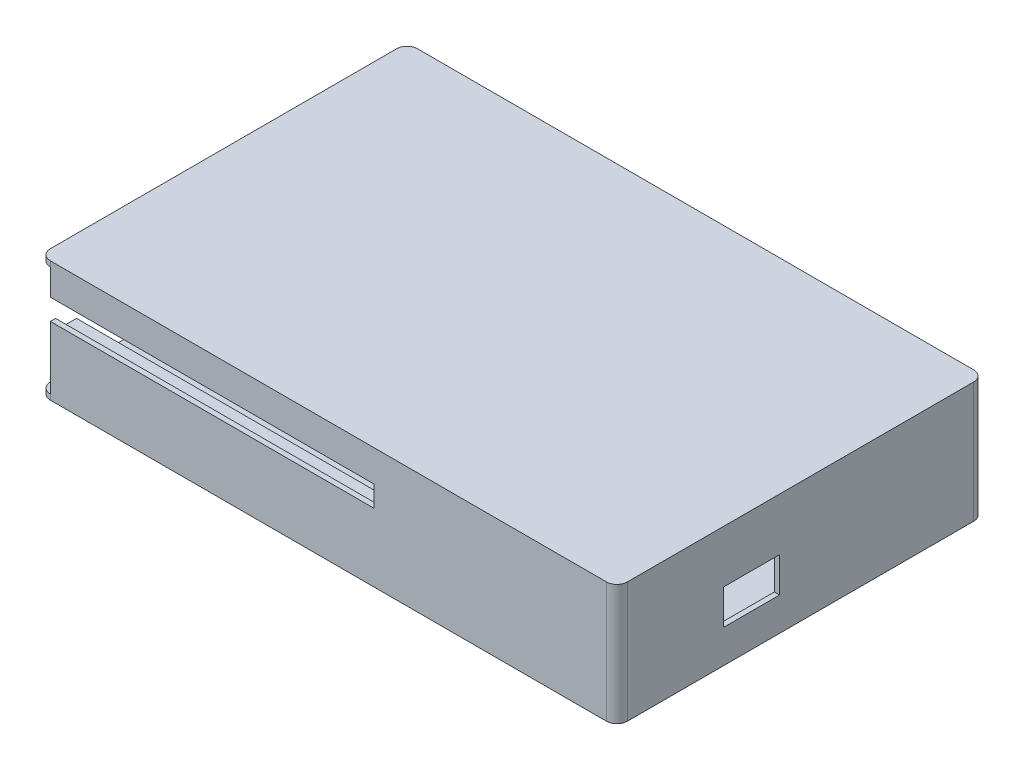
from build123d import *

# Parameters (mm, degrees)
BOSS_EXTRUDE1_DEPTH  = 0.75
BOSS_EXTRUDE2_DEPTH  = 3.75
BOSS_EXTRUDE3_DEPTH  = 9.75
SKETCH1_5_W          = 0.75
SKETCH1_5_H          = 8
BOSS_EXTRUDE4_DEPTH  = 4.75
BOSS_EXTRUDE5_START  = 9.75
BOSS_EXTRUDE5_DEPTH  = 7
BOSS_EXTRUDE6_START  = 5.25
BOSS_EXTRUDE6_DEPTH  = 3
BOSS_EXTRUDE7_START  = 12.75
SKETCH1_11_W         = 46.25
SKETCH1_11_H         = 0.75
BOSS_EXTRUDE7_DEPTH  = 4
BOSS_EXTRUDE9_START  = 16.5
BOSS_EXTRUDE9_DEPTH  = 0.75
SKETCH3_W            = 80.25
SKETCH3_H            = 3
BOSS_EXTRUDE10_DEPTH = 1.5
SKETCH6_W            = 80.25
SKETCH6_H            = 3
BOSS_EXTRUDE11_DEPTH = 1.5
SKETCH4_R            = 0.6
CUT_EXTRUDE1_DEPTH   = 79
SKETCH7_R            = 0.6
CUT_EXTRUDE2_DEPTH   = 79


with BuildPart() as part:
    # Sketch1 → Boss-Extrude1 (new body)
    with BuildSketch(Plane(origin=(0, 0, 0), x_dir=(1, 0, 0), z_dir=(0, 1, 0))):
        with BuildLine():
            Line((0.75, 51.75), (80.25, 51.75))
            ThreePointArc((80.25, 51.75), (81.310660172, 51.310660172), (81.75, 50.25))
            Line((81.75, 50.25), (81.75, 0.75))
            ThreePointArc((81.75, 0.75), (81.310660172, -0.310660172), (80.25, -0.75))
            Line((80.25, -0.75), (0.75, -0.75))
            ThreePointArc((0.75, -0.75), (-0.310660172, -0.310660172), (-0.75, 0.75))
            Line((-0.75, 0.75), (-0.75, 50.25))
            ThreePointArc((-0.75, 50.25), (-0.310660172, 51.310660172), (0.75, 51.75))
        make_face()
    extrude(amount=BOSS_EXTRUDE1_DEPTH)

    # Sketch1<3> → Boss-Extrude2 (add)
    with BuildSketch(Plane(origin=(0, 0, 0), x_dir=(1, 0, 0), z_dir=(0, 1, 0))):
        with BuildLine():
            Line((80.25, 51), (0.75, 51))
            Line((0.75, 51), (0.75, 49.5))
            Line((0.75, 49.5), (81, 49.5))
            Line((81, 49.5), (81, 50.25))
            ThreePointArc((81, 50.25), (80.780330086, 50.780330086), (80.25, 51))
        make_face()
        with BuildLine():
            Line((81, 1.5), (0.75, 1.5))
            Line((0.75, 1.5), (0.75, 0))
            Line((0.75, 0), (80.25, 0))
            ThreePointArc((80.25, 0), (80.780330086, 0.219669914), (81, 0.75))
            Line((81, 0.75), (81, 1.5))
        make_face()
    extrude(amount=BOSS_EXTRUDE2_DEPTH)

    # Sketch1<4> → Boss-Extrude3 (add)
    with BuildSketch(Plane(origin=(0, 0, 0), x_dir=(1, 0, 0), z_dir=(0, 1, 0))):
        with BuildLine():
            Line((0.75, 51.75), (0.75, 51))
            Line((0.75, 51), (80.25, 51))
            ThreePointArc((80.25, 51), (80.780330086, 50.780330086), (81, 50.25))
            Line((81, 50.25), (81, 22.5))
            Line((81, 22.5), (81.75, 22.5))
            Line((81.75, 22.5), (81.75, 50.25))
            ThreePointArc((81.75, 50.25), (81.310660172, 51.310660172), (80.25, 51.75))
            Line((80.25, 51.75), (0.75, 51.75))
        make_face()
        with BuildLine():
            Line((0.75, 0), (0.75, -0.75))
            Line((0.75, -0.75), (80.25, -0.75))
            ThreePointArc((80.25, -0.75), (81.310660172, -0.310660172), (81.75, 0.75))
            Line((81.75, 0.75), (81.75, 14.5))
            Line((81.75, 14.5), (81, 14.5))
            Line((81, 14.5), (81, 0.75))
            ThreePointArc((81, 0.75), (80.780330086, 0.219669914), (80.25, 0))
            Line((80.25, 0), (0.75, 0))
        make_face()
    extrude(amount=BOSS_EXTRUDE3_DEPTH)

    # Sketch1<5> → Boss-Extrude4 (add)
    with BuildSketch(Plane(origin=(0, 0, 0), x_dir=(1, 0, 0), z_dir=(0, 1, 0))):
        with Locations((81.375, 18.5)):
            Rectangle(SKETCH1_5_W, SKETCH1_5_H)
    extrude(amount=BOSS_EXTRUDE4_DEPTH)

    # Sketch1<8> → Boss-Extrude5 (add)
    with BuildSketch(Plane(origin=(0, 0, 0), x_dir=(1, 0, 0), z_dir=(0, 1, 0)).offset(BOSS_EXTRUDE5_START)):
        with BuildLine():
            Line((80.25, 51.75), (47, 51.75))
            Line((47, 51.75), (47, 51))
            Line((47, 51), (80.25, 51))
            ThreePointArc((80.25, 51), (80.780330086, 50.780330086), (81, 50.25))
            Line((81, 50.25), (81, 0.75))
            ThreePointArc((81, 0.75), (80.780330086, 0.219669914), (80.25, 0))
            Line((80.25, 0), (47, 0))
            Line((47, 0), (47, -0.75))
            Line((47, -0.75), (80.25, -0.75))
            ThreePointArc((80.25, -0.75), (81.310660172, -0.310660172), (81.75, 0.75))
            Line((81.75, 0.75), (81.75, 50.25))
            ThreePointArc((81.75, 50.25), (81.310660172, 51.310660172), (80.25, 51.75))
        make_face()
    extrude(amount=BOSS_EXTRUDE5_DEPTH)

    # Sketch1<9> → Boss-Extrude6 (add)
    with BuildSketch(Plane(origin=(0, 0, 0), x_dir=(1, 0, 0), z_dir=(0, 1, 0)).offset(BOSS_EXTRUDE6_START)):
        with BuildLine():
            Line((80.25, 51), (0.75, 51))
            Line((0.75, 51), (0.75, 49.5))
            Line((0.75, 49.5), (81, 49.5))
            Line((81, 49.5), (81, 50.25))
            ThreePointArc((81, 50.25), (80.780330086, 50.780330086), (80.25, 51))
        make_face()
        with BuildLine():
            Line((81, 1.5), (0.75, 1.5))
            Line((0.75, 1.5), (0.75, 0))
            Line((0.75, 0), (80.25, 0))
            ThreePointArc((80.25, 0), (80.780330086, 0.219669914), (81, 0.75))
            Line((81, 0.75), (81, 1.5))
        make_face()
    extrude(amount=BOSS_EXTRUDE6_DEPTH)

    # Sketch1<11> → Boss-Extrude7 (add)
    with BuildSketch(Plane(origin=(0, 0, 0), x_dir=(1, 0, 0), z_dir=(0, 1, 0)).offset(BOSS_EXTRUDE7_START)):
        with Locations((23.875, 51.375)):
            Rectangle(SKETCH1_11_W, SKETCH1_11_H)
        with Locations((23.875, -0.375)):
            Rectangle(SKETCH1_11_W, SKETCH1_11_H)
    extrude(amount=BOSS_EXTRUDE7_DEPTH)

    # Sketch1<12> → Boss-Extrude9 (add)
    with BuildSketch(Plane(origin=(0, 0, 0), x_dir=(1, 0, 0), z_dir=(0, 1, 0)).offset(BOSS_EXTRUDE9_START)):
        with BuildLine():
            ThreePointArc((0.75, 51.75), (-0.310660172, 51.310660172), (-0.75, 50.25))
            Line((-0.75, 50.25), (-0.75, 0.75))
            ThreePointArc((-0.75, 0.75), (-0.310660172, -0.310660172), (0.75, -0.75))
            Line((0.75, -0.75), (80.25, -0.75))
            ThreePointArc((80.25, -0.75), (81.310660172, -0.310660172), (81.75, 0.75))
            Line((81.75, 0.75), (81.75, 50.25))
            ThreePointArc((81.75, 50.25), (81.310660172, 51.310660172), (80.25, 51.75))
            Line((80.25, 51.75), (0.75, 51.75))
        make_face()
    extrude(amount=BOSS_EXTRUDE9_DEPTH)

    # Sketch3 → Boss-Extrude10 (add)
    with BuildSketch(Plane.XY.offset(-49.5)):
        with Locations((40.875, 6.75)):
            Rectangle(SKETCH3_W, SKETCH3_H)
    extrude(amount=BOSS_EXTRUDE10_DEPTH)

    # Sketch6 → Boss-Extrude11 (add)
    with BuildSketch(Plane(origin=(0, 0, -1.5), x_dir=(-1, 0, 0), z_dir=(0, 0, -1))):
        with Locations((-40.875, 6.75)):
            Rectangle(SKETCH6_W, SKETCH6_H)
    extrude(amount=BOSS_EXTRUDE11_DEPTH)

    # Sketch4 → Cut-Extrude1 (cut)
    with BuildSketch(Plane.ZY.offset(-0.75)):
        with Locations((-49.5, 6.75)):
            Circle(SKETCH4_R)
    extrude(amount=-CUT_EXTRUDE1_DEPTH, mode=Mode.SUBTRACT)

    # Sketch7 → Cut-Extrude2 (cut)
    with BuildSketch(Plane.ZY.offset(-0.75)):
        with Locations((-1.5, 6.75)):
            Circle(SKETCH7_R)
    extrude(amount=-CUT_EXTRUDE2_DEPTH, mode=Mode.SUBTRACT)


solid = part.part
